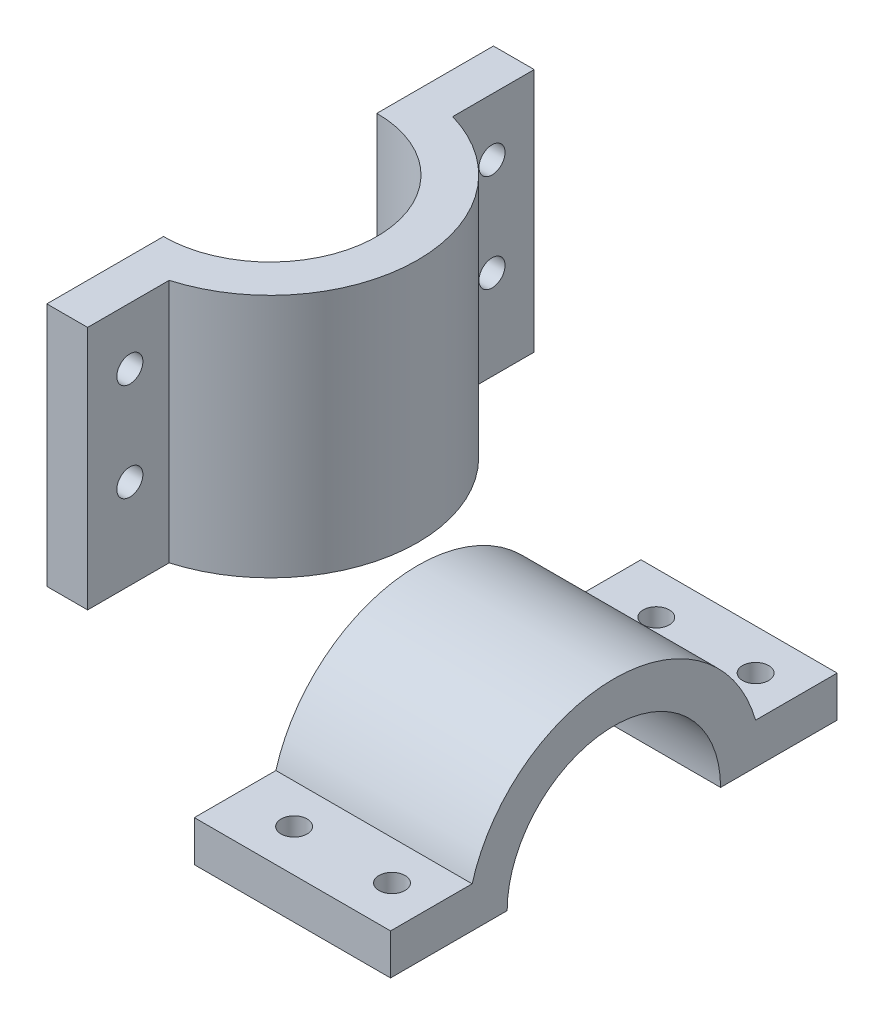
from build123d import *

# Parameters (mm, degrees)
BOSS_EXTRUDE2_DEPTH = 30
BOSS_EXTRUDE3_DEPTH = 24.057106
SKETCH8_R           = 1.6
CUT_EXTRUDE3_DEPTH  = 365.96801264
SKETCH10_R          = 1.6
CUT_EXTRUDE4_DEPTH  = 810.046786406


with BuildPart() as part:
    # Sketch5 → Boss-Extrude2 (new body)
    with BuildSketch(Plane(origin=(0, -152.4, 0), x_dir=(1, 0, 0), z_dir=(0, 1, 0))):
        with BuildLine():
            Line((-749.5, -256.025020287), (-749.5, -259.969))
            ThreePointArc((-749.5, -259.969), (-736.419, -273.05), (-749.5, -286.131))
            Line((-749.5, -286.131), (-749.5, -290.074979713))
            Line((-749.5, -290.074979713), (-749.5, -300.425918997))
            Line((-749.5, -300.425918997), (-744.5, -300.425918997))
            Line((-744.5, -300.425918997), (-744.5, -290.425918997))
            ThreePointArc((-744.5, -290.425918997), (-731.419, -273.05), (-744.5, -255.674081003))
            Line((-744.5, -255.674081003), (-744.5, -245.674081003))
            Line((-744.5, -245.674081003), (-749.5, -245.674081003))
            Line((-749.5, -245.674081003), (-749.5, -256.025020287))
        make_face()
    extrude(amount=-BOSS_EXTRUDE2_DEPTH)

    # Sketch8 → Cut-Extrude3 (cut, through all)
    with BuildSketch(Plane.ZY.offset(749.5)):
        with Locations((295.250449355, -159.4)):
            Circle(SKETCH8_R)
        with Locations((295.250449355, -171.4)):
            Circle(SKETCH8_R)
        with Locations((250.849550645, -171.4)):
            Circle(SKETCH8_R)
        with Locations((250.849550645, -159.4)):
            Circle(SKETCH8_R)
    extrude(amount=-CUT_EXTRUDE3_DEPTH, mode=Mode.SUBTRACT)


with BuildPart() as body_2:
    # Sketch6 → Boss-Extrude3 (new body)
    with BuildSketch(Plane(origin=(-707.361893949, 0, 0), x_dir=(0, 0, -1), z_dir=(1, 0, 0))):
        with BuildLine():
            Line((-291.131, -202.904651163), (-300.425918997, -202.904651163))
            Line((-300.425918997, -202.904651163), (-300.425918997, -197.904651163))
            Line((-300.425918997, -197.904651163), (-290.425918997, -197.904651163))
            ThreePointArc((-290.425918997, -197.904651163), (-273.05, -184.823651163), (-255.674081003, -197.904651163))
            Line((-255.674081003, -197.904651163), (-245.674081003, -197.904651163))
            Line((-245.674081003, -197.904651163), (-245.674081003, -202.904651163))
            Line((-245.674081003, -202.904651163), (-254.969, -202.904651163))
            Line((-254.969, -202.904651163), (-259.969, -202.904651163))
            ThreePointArc((-259.969, -202.904651163), (-273.05, -189.823651163), (-286.131, -202.904651163))
            Line((-286.131, -202.904651163), (-291.131, -202.904651163))
        make_face()
    extrude(amount=-BOSS_EXTRUDE3_DEPTH)

    # Sketch10 → Cut-Extrude4 (cut, through all)
    with BuildSketch(Plane.XZ.offset(202.904651163)):
        with Locations(Location((-724.361893949, 295.250449355, 0), (0, 0, 270))):
            Circle(SKETCH10_R)
        with Locations(Location((-712.361893949, 295.250449355, 0), (0, 0, 270))):
            Circle(SKETCH10_R)
        with Locations(Location((-712.361893949, 250.674081003, 0), (0, 0, 270))):
            Circle(SKETCH10_R)
        with Locations(Location((-724.361893949, 250.849550645, 0), (0, 0, 270))):
            Circle(SKETCH10_R)
    extrude(amount=-CUT_EXTRUDE4_DEPTH, mode=Mode.SUBTRACT)


solid = Compound([part.part, body_2.part])
